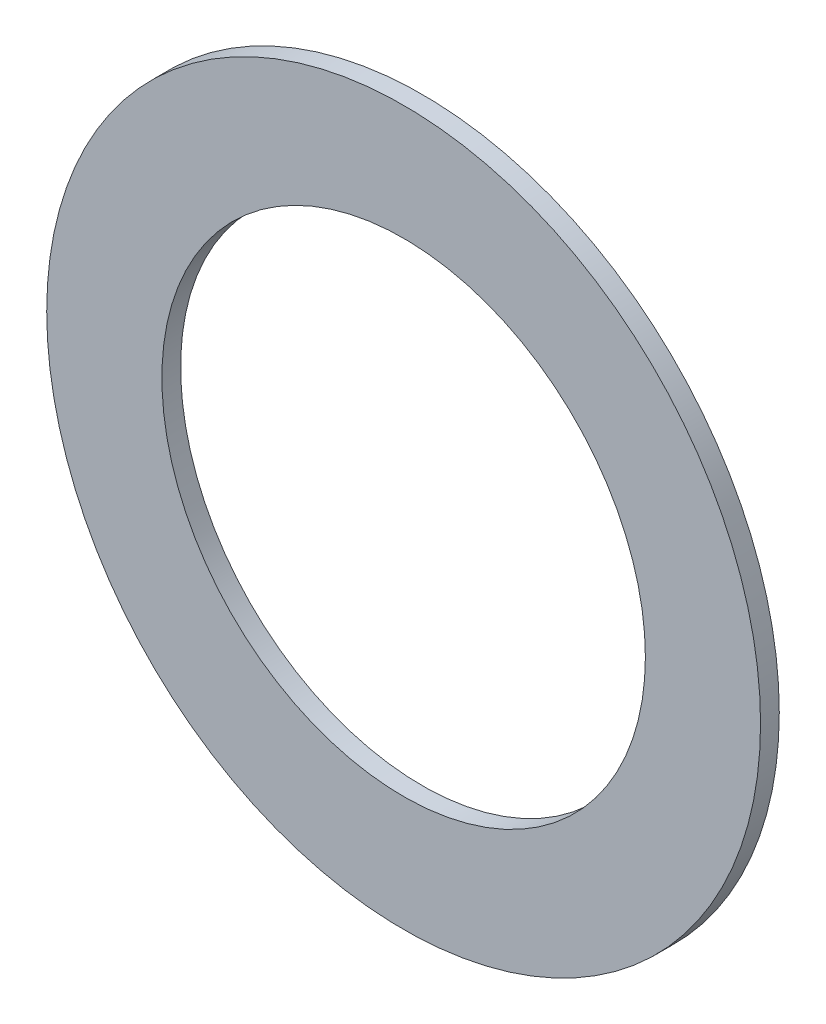
from build123d import *

# Parameters (mm, degrees)
SKETCH1_R           = 76.2
SKETCH1_R_2         = 51.6125
BOSS_EXTRUDE1_DEPTH = 4


with BuildPart() as part:
    # Sketch1 → Boss-Extrude1 (new body)
    with BuildSketch(Plane.XY):
        Circle(SKETCH1_R)
        Circle(SKETCH1_R_2, mode=Mode.SUBTRACT)
    extrude(amount=BOSS_EXTRUDE1_DEPTH)


solid = part.part
